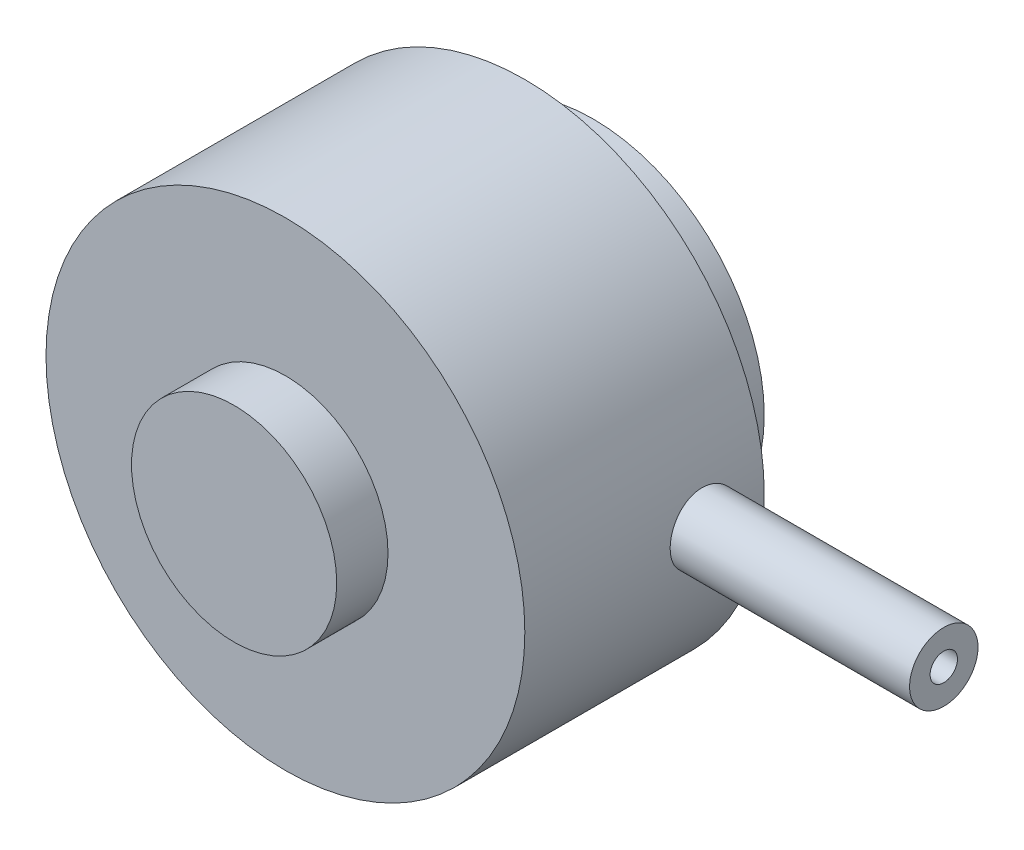
from build123d import *

# Parameters (mm, degrees)
SKETCH1_R           = 5
BOSS_EXTRUDE1_DEPTH = 2
SKETCH2_R           = 7
BOSS_EXTRUDE2_DEPTH = 7
SKETCH3_R           = 3
BOSS_EXTRUDE3_DEPTH = 1.5
SKETCH4_R           = 1
BOSS_EXTRUDE4_DEPTH = 8
SKETCH5_R           = 0.4
CUT_EXTRUDE1_DEPTH  = 8
SKETCH7_R           = 0.35
CUT_EXTRUDE2_DEPTH  = 0.4


with BuildPart() as part:
    # Sketch1 → Boss-Extrude1 (new body)
    with BuildSketch(Plane.XY):
        Circle(SKETCH1_R)
    extrude(amount=BOSS_EXTRUDE1_DEPTH)

    # Sketch2 → Boss-Extrude2 (add)
    with BuildSketch(Plane.XY.offset(2)):
        Circle(SKETCH2_R)
    extrude(amount=BOSS_EXTRUDE2_DEPTH)

    # Sketch3 → Boss-Extrude3 (add)
    with BuildSketch(Plane.XY.offset(9)):
        Circle(SKETCH3_R)
    extrude(amount=BOSS_EXTRUDE3_DEPTH)

    # Sketch4 → Boss-Extrude4 (add)
    with BuildSketch(Plane(origin=(6, 0, 0), x_dir=(0, 0, -1), z_dir=(1, 0, 0))):
        with Locations((-3.75, 0)):
            Circle(SKETCH4_R)
    extrude(amount=BOSS_EXTRUDE4_DEPTH)

    # Sketch5 → Cut-Extrude1 (cut)
    with BuildSketch(Plane(origin=(14, 0, 0), x_dir=(0, 0, -1), z_dir=(1, 0, 0))):
        with Locations((-3.75, 0)):
            Circle(SKETCH5_R)
    extrude(amount=-CUT_EXTRUDE1_DEPTH, mode=Mode.SUBTRACT)

    # Sketch7 → Cut-Extrude2 (cut)
    with BuildSketch(Plane(origin=(0, 0, 0), x_dir=(-1, 0, 0), z_dir=(0, 0, -1))):
        Circle(SKETCH7_R)
        with Locations((0, 2)):
            Circle(SKETCH7_R)
        with Locations((0, -2)):
            Circle(SKETCH7_R)
        with Locations((2, 0)):
            Circle(SKETCH7_R)
        with Locations((2, 2)):
            Circle(SKETCH7_R)
        with Locations((2, -2)):
            Circle(SKETCH7_R)
        with Locations((-2, 0)):
            Circle(SKETCH7_R)
        with Locations((-2, 2)):
            Circle(SKETCH7_R)
        with Locations((-2, -2)):
            Circle(SKETCH7_R)
    extrude(amount=-CUT_EXTRUDE2_DEPTH, mode=Mode.SUBTRACT)


solid = part.part
